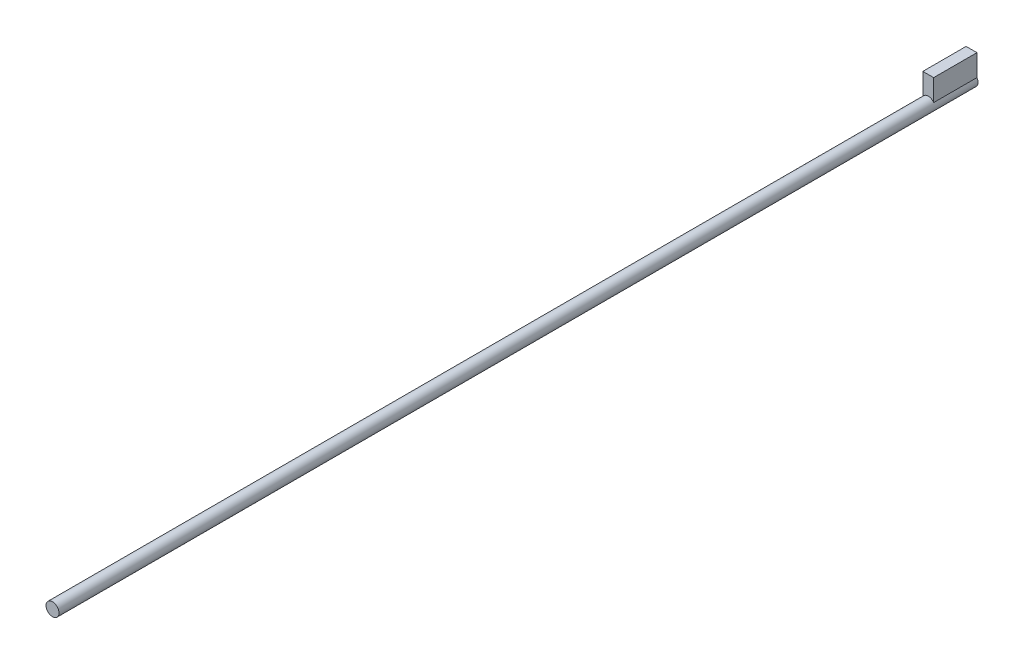
from build123d import *

# Parameters (mm, degrees)
SKETCH1_R           = 1.5
BOSS_EXTRUDE1_DEPTH = 212.4
BOSS_EXTRUDE2_DEPTH = 10


with BuildPart() as part:
    # Sketch1 → Boss-Extrude1 (new body)
    with BuildSketch(Plane.XY):
        Circle(SKETCH1_R)
    extrude(amount=BOSS_EXTRUDE1_DEPTH)

    # Sketch2 → Boss-Extrude2 (add)
    with BuildSketch(Plane(origin=(0, 0, 0), x_dir=(-1, 0, 0), z_dir=(0, 0, -1))):
        with BuildLine():
            Line((-1.25, 5.829156198), (-1.25, 0.829156198))
            ThreePointArc((-1.25, 0.829156198), (0, 1.5), (1.25, 0.829156198))
            Line((1.25, 0.829156198), (1.25, 5.829156198))
            Line((1.25, 5.829156198), (-1.25, 5.829156198))
        make_face()
    extrude(amount=-BOSS_EXTRUDE2_DEPTH)


solid = part.part
